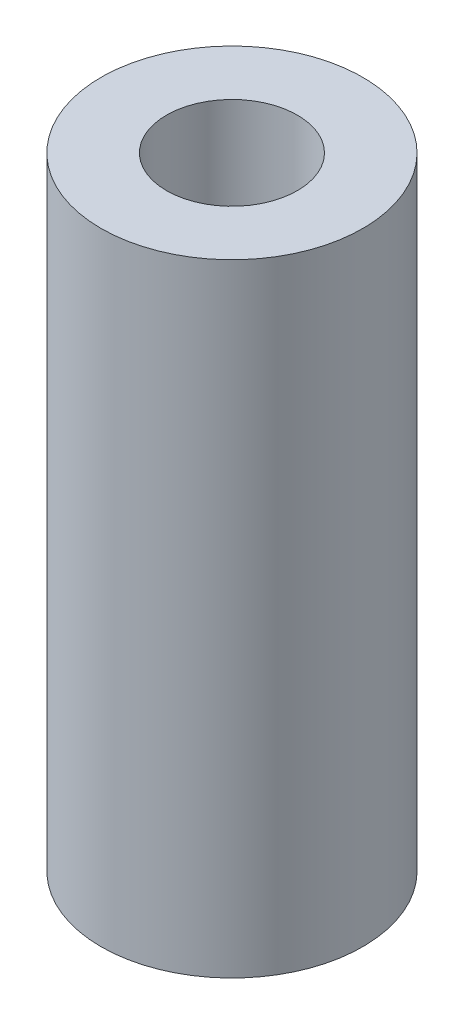
from build123d import *

# Parameters (mm, degrees)
SKETCH1_R           = 6.35
SKETCH1_R_2         = 3.175
BOSS_EXTRUDE1_DEPTH = 30.1752


with BuildPart() as part:
    # Sketch1 → Boss-Extrude1 (new body)
    with BuildSketch(Plane(origin=(0, 0, 0), x_dir=(1, 0, 0), z_dir=(0, 1, 0))):
        with Locations(Location((0, 0, 0), (0, 0, 270))):
            Circle(SKETCH1_R)
        with Locations(Location((0, 0, 0), (0, 0, 270))):
            Circle(SKETCH1_R_2, mode=Mode.SUBTRACT)
    extrude(amount=BOSS_EXTRUDE1_DEPTH)


solid = part.part
